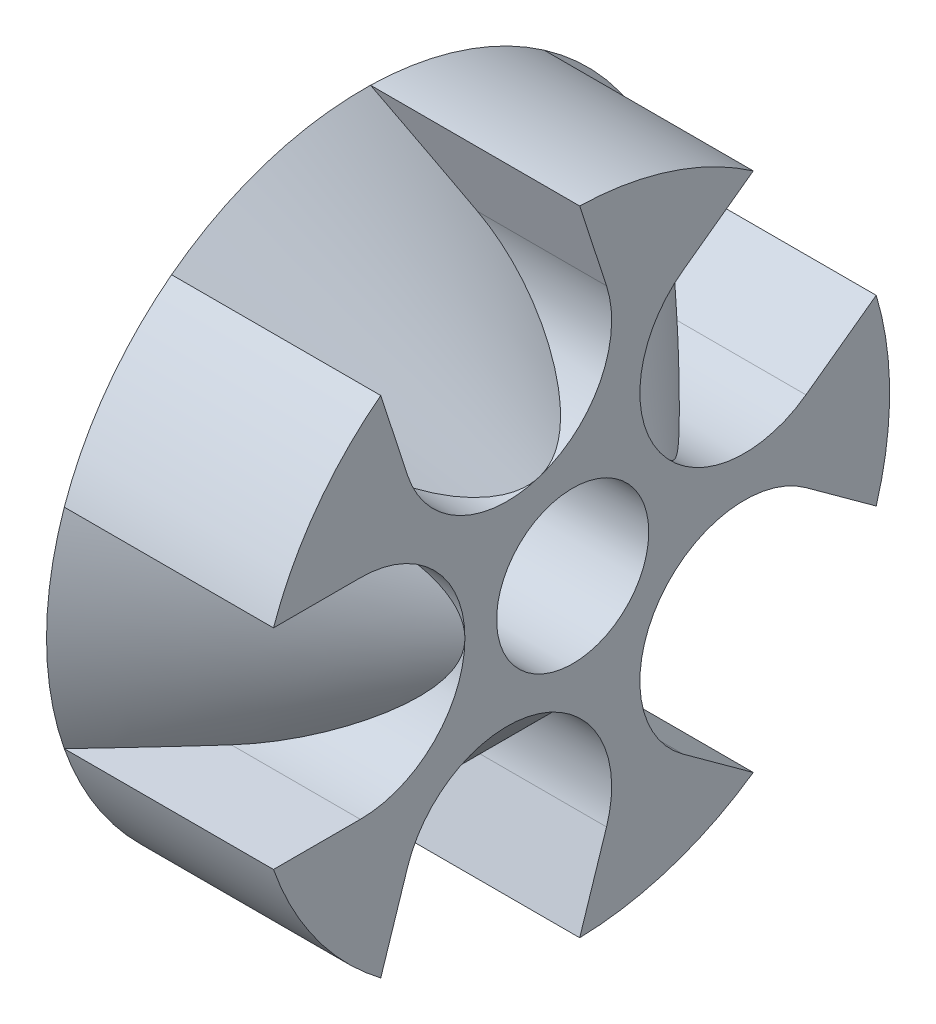
from build123d import *

# Parameters (mm, degrees)
SKETCH1_R           = 25
SKETCH1_R_2         = 6
BOSS_EXTRUDE1_DEPTH = 16.5
CUT_EXTRUDE3_DEPTH  = 30


with BuildPart() as part:
    # Sketch1 → Boss-Extrude1 (new body)
    with BuildSketch(Plane(origin=(0, 0, 0), x_dir=(0, 0, -1), z_dir=(1, 0, 0))):
        Circle(SKETCH1_R)
        Circle(SKETCH1_R_2, mode=Mode.SUBTRACT)
    extrude(amount=BOSS_EXTRUDE1_DEPTH)

    # Sketch4 → Cut-Extrude3 (cut)
    with BuildSketch(Plane(origin=(16.5, 0, 0), x_dir=(0, 0, -1), z_dir=(1, 0, 0))):
        with BuildLine():
            Line((-16.75, 8.25), (-27.17881333, 8.25))
            Line((-27.17881333, 8.25), (-27.17881333, -8.25))
            Line((-27.17881333, -8.25), (-16.75, -8.25))
            ThreePointArc((-16.75, -8.25), (-8.5, 0), (-16.75, 8.25))
        make_face()
        with BuildLine():
            Line((2.670181604, 18.479586852), (-0.552498946, 28.397977726))
            Line((-0.552498946, 28.397977726), (-16.244931465, 23.299197319))
            Line((-16.244931465, 23.299197319), (-13.022250915, 13.380806444))
            ThreePointArc((-13.022250915, 13.380806444), (-2.626644452, 8.083980389), (2.670181604, 18.479586852))
        make_face()
        with BuildLine():
            Line((18.400262987, 3.171012772), (26.837350202, 9.300915446))
            Line((26.837350202, 9.300915446), (17.138893539, 22.649695854))
            Line((17.138893539, 22.649695854), (8.701806324, 16.519793179))
            ThreePointArc((8.701806324, 16.519793179), (6.876644452, 4.996174644), (18.400262987, 3.171012772))
        make_face()
        with BuildLine():
            Line((8.701806324, -16.519793179), (17.138893539, -22.649695854))
            Line((17.138893539, -22.649695854), (26.837350202, -9.300915446))
            Line((26.837350202, -9.300915446), (18.400262987, -3.171012772))
            ThreePointArc((18.400262987, -3.171012772), (6.876644452, -4.996174644), (8.701806324, -16.519793179))
        make_face()
        with BuildLine():
            Line((-13.022250915, -13.380806444), (-16.244931465, -23.299197319))
            Line((-16.244931465, -23.299197319), (-0.552498946, -28.397977726))
            Line((-0.552498946, -28.397977726), (2.670181604, -18.479586852))
            ThreePointArc((2.670181604, -18.479586852), (-2.626644452, -8.083980389), (-13.022250915, -13.380806444))
        make_face()
    extrude(amount=-CUT_EXTRUDE3_DEPTH, mode=Mode.SUBTRACT)

    # Sketch6 → Revolve1 (revolve)
    with BuildSketch(Plane(origin=(0, 0, 0), x_dir=(1, 0, 0), z_dir=(0, 1, 0))):
        Polygon((0, -25), (16.5, -8.5), (0, -8.5), align=None)
    revolve(axis=Axis((27.230838135, 0, 0), (-1, 0, 0)))


solid = part.part
